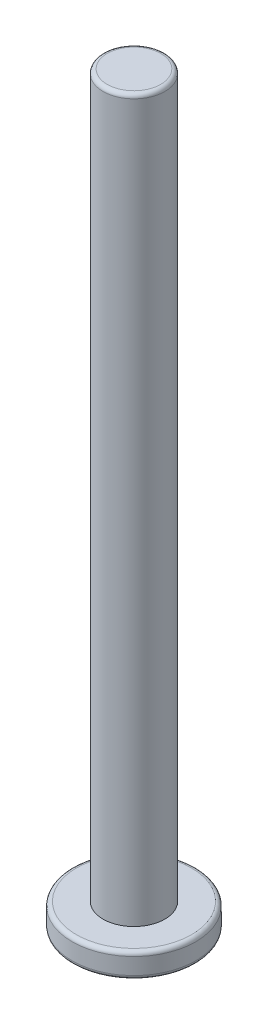
from build123d import *

# Parameters (mm, degrees)
FILLET1_R          = 0.2
CUT_EXTRUDE1_DEPTH = 1


with BuildPart() as part:
    # Sketch2 → Revolve1 (revolve)
    with BuildSketch(Plane.XY, mode=Mode.PRIVATE) as revolve1_sk:
        Polygon((0, 0), (3, 0), (3, 1.2), (1.5, 1.2), (1.5, 36.2), (0, 36.2), align=None)
    revolve(revolve1_sk.sketch.rotate(Axis((0, 73.114266362, 0), (0, -1, 0)), 90), axis=Axis((0, 73.114266362, 0), (0, -1, 0)))

    # Fillet1
    fillet1_edges = [part.edges().sort_by_distance(p)[0] for p in [
        (0, 36.2, -1.5),
        (0, 1.2, -3),
        (0, 0, -3),
    ]]
    fillet(fillet1_edges, radius=FILLET1_R)

    # Sketch3 → Cut-Extrude1 (cut)
    with BuildSketch(Plane.XZ):
        Polygon((1.443375673, 0), (0.721687836, 1.25), (-0.721687836, 1.25), (-1.443375673, 0), (-0.721687836, -1.25), (0.721687836, -1.25), align=None)
    extrude(amount=-CUT_EXTRUDE1_DEPTH, mode=Mode.SUBTRACT)


solid = part.part
